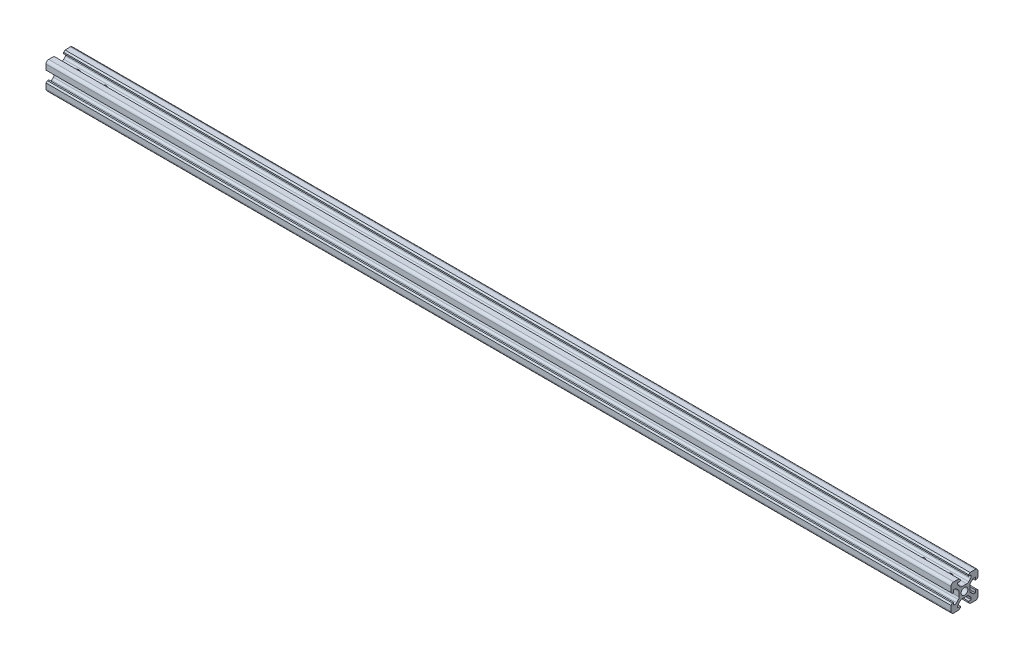
from build123d import *

# Parameters (mm, degrees)
SKETCH1_R           = 2.5
BOSS_EXTRUDE1_DEPTH = 670
SKETCH2_R           = 2.5
CUT_EXTRUDE1_DEPTH  = 671.373030484


with BuildPart() as part:
    # Sketch1 → Boss-Extrude1 (new body)
    with BuildSketch(Plane(origin=(0, 0, 0), x_dir=(0, 0, -1), z_dir=(1, 0, 0))):
        with BuildLine():
            Line((-4.1, 10), (-8, 10))
            ThreePointArc((-8, 10), (-9.414213562, 9.414213562), (-10, 8))
            Line((-10, 8), (-10, 4.1))
            Line((-10, 4.1), (-9, 3.1))
            Line((-9, 3.1), (-8, 3.1))
            Line((-8, 3.1), (-8, 5))
            Line((-8, 5), (-7.242640687, 5))
            ThreePointArc((-7.242640687, 5), (-6.477273822, 4.847759065), (-5.828427125, 4.414213562))
            Line((-5.828427125, 4.414213562), (-4.537854624, 3.123641061))
            ThreePointArc((-4.537854624, 3.123641061), (-4.104309121, 2.474794364), (-3.952068186, 1.709427499))
            Line((-3.952068186, 1.709427499), (-3.952068186, -1.709427499))
            ThreePointArc((-3.952068186, -1.709427499), (-4.104309121, -2.474794364), (-4.537854624, -3.123641061))
            Line((-4.537854624, -3.123641061), (-5.828427125, -4.414213562))
            ThreePointArc((-5.828427125, -4.414213562), (-6.477273822, -4.847759065), (-7.242640687, -5))
            Line((-7.242640687, -5), (-8, -5))
            Line((-8, -5), (-8, -3.1))
            Line((-8, -3.1), (-9, -3.1))
            Line((-9, -3.1), (-10, -4.1))
            Line((-10, -4.1), (-10, -8))
            ThreePointArc((-10, -8), (-9.414213562, -9.414213562), (-8, -10))
            Line((-8, -10), (-4.1, -10))
            Line((-4.1, -10), (-3.1, -9))
            Line((-3.1, -9), (-3.1, -8))
            Line((-3.1, -8), (-5, -8))
            Line((-5, -8), (-5, -7.242640687))
            ThreePointArc((-5, -7.242640687), (-4.847759065, -6.477273822), (-4.414213562, -5.828427125))
            Line((-4.414213562, -5.828427125), (-3.123641061, -4.537854624))
            ThreePointArc((-3.123641061, -4.537854624), (-2.474794364, -4.104309121), (-1.709427499, -3.952068186))
            Line((-1.709427499, -3.952068186), (1.709427499, -3.952068186))
            ThreePointArc((1.709427499, -3.952068186), (2.474794364, -4.104309121), (3.123641061, -4.537854624))
            Line((3.123641061, -4.537854624), (4.414213562, -5.828427125))
            ThreePointArc((4.414213562, -5.828427125), (4.847759065, -6.477273822), (5, -7.242640687))
            Line((5, -7.242640687), (5, -8))
            Line((5, -8), (3.1, -8))
            Line((3.1, -8), (3.1, -9))
            Line((3.1, -9), (4.1, -10))
            Line((4.1, -10), (8, -10))
            ThreePointArc((8, -10), (9.414213562, -9.414213562), (10, -8))
            Line((10, -8), (10, -4.1))
            Line((10, -4.1), (9, -3.1))
            Line((9, -3.1), (8, -3.1))
            Line((8, -3.1), (8, -5))
            Line((8, -5), (7.242640687, -5))
            ThreePointArc((7.242640687, -5), (6.477273822, -4.847759065), (5.828427125, -4.414213562))
            Line((5.828427125, -4.414213562), (4.537854624, -3.123641061))
            ThreePointArc((4.537854624, -3.123641061), (4.104309121, -2.474794364), (3.952068186, -1.709427499))
            Line((3.952068186, -1.709427499), (3.952068186, 1.709427499))
            ThreePointArc((3.952068186, 1.709427499), (4.104309121, 2.474794364), (4.537854624, 3.123641061))
            Line((4.537854624, 3.123641061), (5.828427125, 4.414213562))
            ThreePointArc((5.828427125, 4.414213562), (6.477273822, 4.847759065), (7.242640687, 5))
            Line((7.242640687, 5), (8, 5))
            Line((8, 5), (8, 3.1))
            Line((8, 3.1), (9, 3.1))
            Line((9, 3.1), (10, 4.1))
            Line((10, 4.1), (10, 8))
            ThreePointArc((10, 8), (9.414213562, 9.414213562), (8, 10))
            Line((8, 10), (4.1, 10))
            Line((4.1, 10), (3.1, 9))
            Line((3.1, 9), (3.1, 8))
            Line((3.1, 8), (5, 8))
            Line((5, 8), (5, 7.242640687))
            ThreePointArc((5, 7.242640687), (4.847759065, 6.477273822), (4.414213562, 5.828427125))
            Line((4.414213562, 5.828427125), (3.123641061, 4.537854624))
            ThreePointArc((3.123641061, 4.537854624), (2.474794364, 4.104309121), (1.709427499, 3.952068186))
            Line((1.709427499, 3.952068186), (-1.709427499, 3.952068186))
            ThreePointArc((-1.709427499, 3.952068186), (-2.474794364, 4.104309121), (-3.123641061, 4.537854624))
            Line((-3.123641061, 4.537854624), (-4.414213562, 5.828427125))
            ThreePointArc((-4.414213562, 5.828427125), (-4.847759065, 6.477273822), (-5, 7.242640687))
            Line((-5, 7.242640687), (-5, 8))
            Line((-5, 8), (-3.1, 8))
            Line((-3.1, 8), (-3.1, 9))
            Line((-3.1, 9), (-4.1, 10))
        make_face()
        Circle(SKETCH1_R, mode=Mode.SUBTRACT)
    extrude(amount=BOSS_EXTRUDE1_DEPTH)

    # Sketch2 → Cut-Extrude1 (cut, through all)
    with BuildSketch(Plane(origin=(0, 10, 0), x_dir=(1, 0, 0), z_dir=(0, 1, 0))):
        with Locations(Location((658, 0, 0), (0, 0, 270))):
            Circle(SKETCH2_R)
        with Locations(Location((638, 0, 0), (0, 0, 270))):
            Circle(SKETCH2_R)
        with Locations(Location((32, 0, 0), (0, 0, 270))):
            Circle(SKETCH2_R)
        with Locations(Location((12, 0, 0), (0, 0, 270))):
            Circle(SKETCH2_R)
    extrude(amount=-CUT_EXTRUDE1_DEPTH, mode=Mode.SUBTRACT)


solid = part.part
